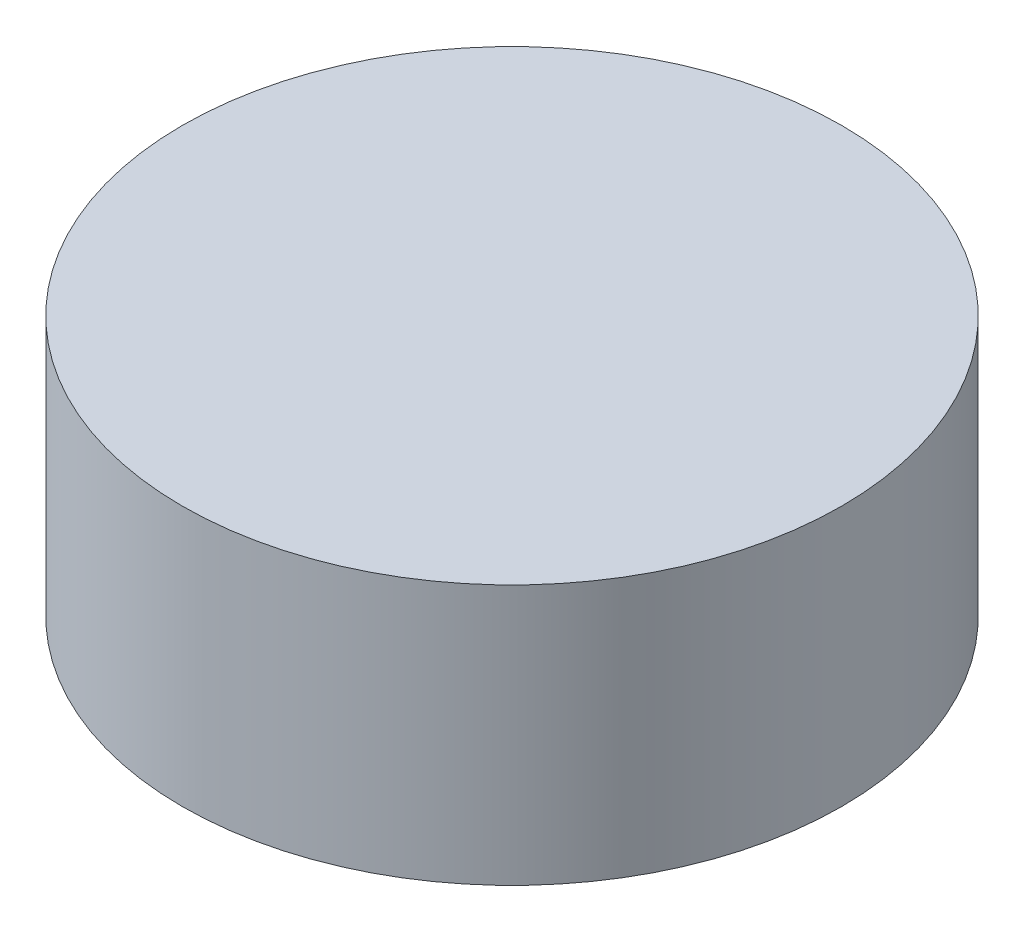
from build123d import *

# Parameters (mm, degrees)
SKETCH1_R           = 38.010678282
BOSS_EXTRUDE1_DEPTH = 30


with BuildPart() as part:
    # Sketch1 → Boss-Extrude1 (new body)
    with BuildSketch(Plane(origin=(0, 0, 0), x_dir=(1, 0, 0), z_dir=(0, 1, 0))):
        with Locations(Location((0, 0, 0), (0, 0, 270))):
            Circle(SKETCH1_R)
    extrude(amount=BOSS_EXTRUDE1_DEPTH)


solid = part.part
